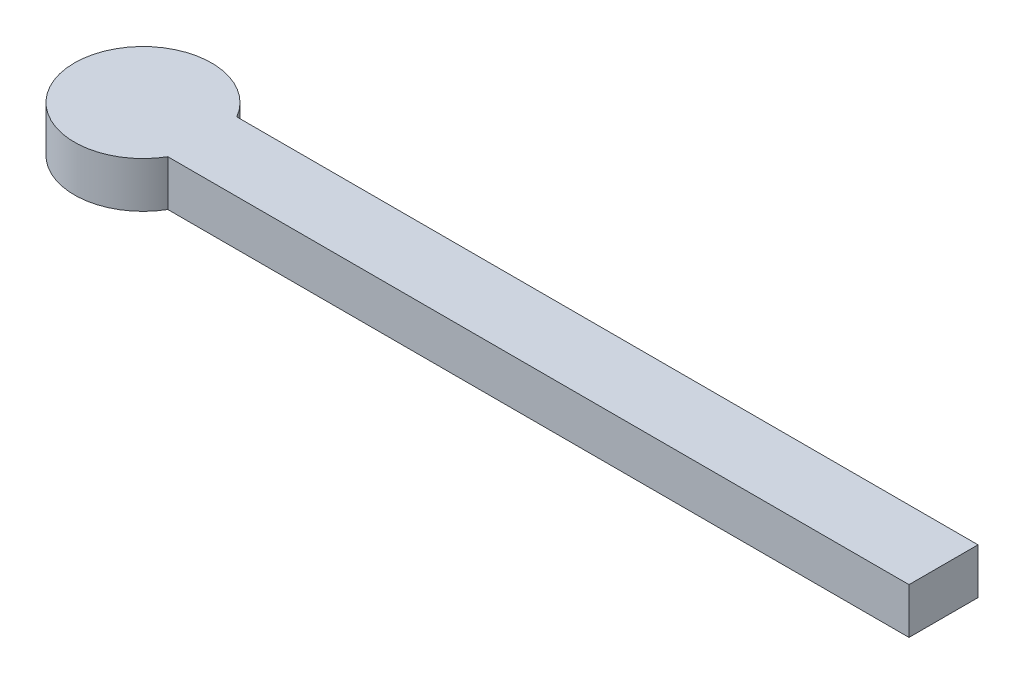
from build123d import *

# Parameters (mm, degrees)
BOSS_EXTRUDE1_DEPTH = 10


with BuildPart() as part:
    # Sketch1 → Boss-Extrude1 (new body)
    with BuildSketch(Plane(origin=(0, 0, 0), x_dir=(1, 0, 0), z_dir=(0, 1, 0))):
        with BuildLine():
            Line((174.95790936, -7.539306861), (12.9676078, -7.539306861))
            ThreePointArc((12.9676078, -7.539306861), (-15, 0), (12.9676078, 7.539306861))
            Line((12.9676078, 7.539306861), (174.95790936, 7.539306861))
            Line((174.95790936, 7.539306861), (174.95790936, -7.539306861))
        make_face()
    extrude(amount=BOSS_EXTRUDE1_DEPTH)


solid = part.part
